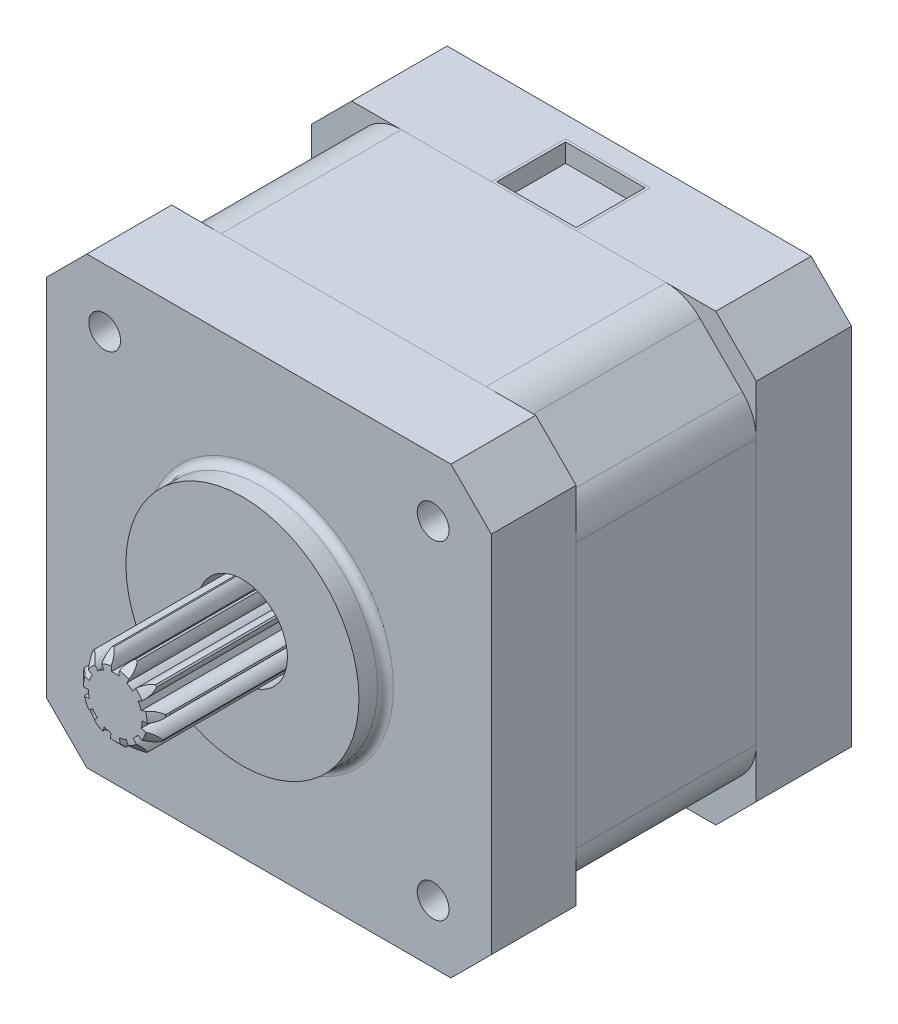
from build123d import *

# Parameters (mm, degrees)
BOSS_EXTRUDE1_DEPTH         = 8
BOSS_EXTRUDE2_DEPTH         = 17
BOSS_EXTRUDE3_DEPTH         = 9
SKETCH5_R                   = 1.5
CUT_EXTRUDE1_DEPTH          = 4.5
SKETCH6_R                   = 11
BOSS_EXTRUDE4_DEPTH         = 2.5
SKETCH9_R                   = 4.25
CUT_EXTRUDE2_DEPTH          = 3
SKETCH8_R                   = 3.9
BOSS_EXTRUDE5_DEPTH         = 15
SKETCH11_R                  = 4
SKETCH11_R_2                = 2.75
BOSS_EXTRUDE6_DEPTH         = 0.5
FILLET1_R                   = 0.75
SKETCH13_W                  = 8
SKETCH13_H                  = 7
CUT_EXTRUDE3_DEPTH          = 2
SKETCH14_W                  = 8
SKETCH14_H                  = 7
BOSS_EXTRUDE7_DEPTH         = 0.25
SKETCH15_W                  = 8
SKETCH15_H                  = 7
SKETCH15_W_2                = 7.5
SKETCH15_H_2                = 6.5
BOSS_EXTRUDE8_DEPTH         = 1.75
WYTNIJ_WYCI_GNI_CIE1_DEPTH  = 15
SZKIC2_R                    = 11
WYTNIJ_WYCI_GNI_CIE2_DEPTH  = 1
WYTNIJ_WYCI_GNI_CIE7_START  = -2
SZKIC2_4_R                  = 4.25
WYTNIJ_WYCI_GNI_CIE7_DEPTH  = 2
SZKIC3_R                    = 3.6
SZKIC3_R_2                  = 3.5
WYTNIJ_WYCI_GNI_CIE10_DEPTH = 5
SZKIC4_R                    = 0.5
WYTNIJ_WYCI_GNI_CIE11_DEPTH = 3
ZAOKR_GLENIE1_R             = 0.5
SFAZOWANIE1_SIZE            = 0.4
SZKIC5_R                    = 3.3
WYTNIJ_WYCI_GNI_CIE12_DEPTH = 3
WYTNIJ_WYCI_GNI_CIE13_START = -15
SZKIC5_3_R                  = 1.5
WYTNIJ_WYCI_GNI_CIE13_DEPTH = 15


with BuildPart() as part:
    # Sketch1 → Boss-Extrude1 (new body)
    with BuildSketch(Plane.XY):
        Polygon((17.183766184, 21), (-17.183766184, 21), (-21, 17.183766184), (-21, -17.183766184), (-17.183766184, -21), (17.183766184, -21), (21, -17.183766184), (21, 17.183766184), align=None)
    extrude(amount=-BOSS_EXTRUDE1_DEPTH)

    # Sketch5 → Cut-Extrude1 (cut)
    with BuildSketch(Plane.XY):
        with Locations((-15.5, 15.5)):
            Circle(SKETCH5_R)
        with Locations((15.5, 15.5)):
            Circle(SKETCH5_R)
        with Locations((15.5, -15.5)):
            Circle(SKETCH5_R)
        with Locations((-15.5, -15.5)):
            Circle(SKETCH5_R)
    extrude(amount=-CUT_EXTRUDE1_DEPTH, mode=Mode.SUBTRACT)

    # Sketch6 → Boss-Extrude4 (add)
    with BuildSketch(Plane.XY):
        with Locations(Location((0, 0, 0), (0, 0, 180))):
            Circle(SKETCH6_R)
    extrude(amount=BOSS_EXTRUDE4_DEPTH)

    # Sketch9 → Cut-Extrude2 (cut)
    with BuildSketch(Plane.XY.offset(2.5)):
        Circle(SKETCH9_R)
    extrude(amount=-CUT_EXTRUDE2_DEPTH, mode=Mode.SUBTRACT)

    # Sketch11 → Boss-Extrude6 (add)
    with BuildSketch(Plane.XY.offset(-0.5)):
        Circle(SKETCH11_R)
        Circle(SKETCH11_R_2, mode=Mode.SUBTRACT)
    extrude(amount=BOSS_EXTRUDE6_DEPTH)

    # Fillet1
    fillet1_edges = [part.edges().sort_by_distance(p)[0] for p in [
        (11, 0, 0),
    ]]
    fillet(fillet1_edges, radius=FILLET1_R)


with BuildPart() as body_2:
    # Sketch3 → Boss-Extrude2 (new body)
    with BuildSketch(Plane(origin=(0, 0, -8), x_dir=(-1, 0, 0), z_dir=(0, 0, -1))):
        with BuildLine():
            Line((-19.68807717, 15.66726189), (-15.66726189, 19.68807717))
            ThreePointArc((-15.66726189, 19.68807717), (-14.214109783, 20.659042365), (-12.5, 21))
            Line((-12.5, 21), (12.5, 21))
            ThreePointArc((12.5, 21), (14.214109783, 20.659042365), (15.66726189, 19.68807717))
            Line((15.66726189, 19.68807717), (19.68807717, 15.66726189))
            ThreePointArc((19.68807717, 15.66726189), (20.659042365, 14.214109783), (21, 12.5))
            Line((21, 12.5), (21, -12.5))
            ThreePointArc((21, -12.5), (20.659042365, -14.214109783), (19.68807717, -15.66726189))
            Line((19.68807717, -15.66726189), (15.66726189, -19.68807717))
            ThreePointArc((15.66726189, -19.68807717), (14.214109783, -20.659042365), (12.5, -21))
            Line((12.5, -21), (-12.5, -21))
            ThreePointArc((-12.5, -21), (-14.214109783, -20.659042365), (-15.66726189, -19.68807717))
            Line((-15.66726189, -19.68807717), (-19.68807717, -15.66726189))
            ThreePointArc((-19.68807717, -15.66726189), (-20.659042365, -14.214109783), (-21, -12.5))
            Line((-21, -12.5), (-21, 12.5))
            ThreePointArc((-21, 12.5), (-20.659042365, 14.214109783), (-19.68807717, 15.66726189))
        make_face()
    extrude(amount=BOSS_EXTRUDE2_DEPTH)


with BuildPart() as body_3:
    # Sketch4 → Boss-Extrude3 (new body)
    with BuildSketch(Plane(origin=(0, 0, -25), x_dir=(-1, 0, 0), z_dir=(0, 0, -1))):
        Polygon((-17.183766184, 21), (-21, 17.183766184), (-21, -17.183766184), (-17.183766184, -21), (17.183766184, -21), (21, -17.183766184), (21, 17.183766184), (17.183766184, 21), align=None)
    extrude(amount=BOSS_EXTRUDE3_DEPTH)

    # Sketch13 → Cut-Extrude3 (cut)
    with BuildSketch(Plane(origin=(0, 21, 0), x_dir=(1, 0, 0), z_dir=(0, 1, 0))):
        with Locations((0, 28.5)):
            Rectangle(SKETCH13_W, SKETCH13_H)
    extrude(amount=-CUT_EXTRUDE3_DEPTH, mode=Mode.SUBTRACT)

    # Szkic2 → Wytnij-wyciągnięcie2 (cut)
    with BuildSketch(Plane(origin=(0, 0, -34), x_dir=(-1, 0, 0), z_dir=(0, 0, -1))):
        Circle(SZKIC2_R)
    extrude(amount=-WYTNIJ_WYCI_GNI_CIE2_DEPTH, mode=Mode.SUBTRACT)

    # Szkic2<4> → Wytnij-wyciągnięcie7 (cut)
    with BuildSketch(Plane(origin=(0, 0, -34), x_dir=(-1, 0, 0), z_dir=(0, 0, -1)).offset(WYTNIJ_WYCI_GNI_CIE7_START)):
        Circle(SZKIC2_4_R)
    extrude(amount=WYTNIJ_WYCI_GNI_CIE7_DEPTH, mode=Mode.SUBTRACT)

    # Szkic3 → Wytnij-wyciągnięcie10 (cut)
    with BuildSketch(Plane(origin=(0, 0, -32), x_dir=(-1, 0, 0), z_dir=(0, 0, -1))):
        Circle(SZKIC3_R)
        Circle(SZKIC3_R_2, mode=Mode.SUBTRACT)
    extrude(amount=-WYTNIJ_WYCI_GNI_CIE10_DEPTH, mode=Mode.SUBTRACT)

    # Szkic4 → Wytnij-wyciągnięcie11 (cut)
    with BuildSketch(Plane(origin=(0, 0, -32), x_dir=(-1, 0, 0), z_dir=(0, 0, -1))):
        Circle(SZKIC4_R)
    extrude(amount=-WYTNIJ_WYCI_GNI_CIE11_DEPTH, mode=Mode.SUBTRACT)

    # Zaokrąglenie1
    zaokr_glenie1_edges = [body_3.edges().sort_by_distance(p)[0] for p in [
        (0.5, 0, -29),
    ]]
    fillet(zaokr_glenie1_edges, radius=ZAOKR_GLENIE1_R)

    # Sfazowanie1
    sfazowanie1_edges = [body_3.edges().sort_by_distance(p)[0] for p in [
        (3.5, 0, -32),
        (0.5, 0, -32),
    ]]
    chamfer(sfazowanie1_edges, length=SFAZOWANIE1_SIZE)

    # Szkic5 → Wytnij-wyciągnięcie12 (cut)
    with BuildSketch(Plane(origin=(0, 0, -34), x_dir=(-1, 0, 0), z_dir=(0, 0, -1))):
        with Locations((-15.5, -15.5)):
            Circle(SZKIC5_R)
        with Locations((-15.5, 15.5)):
            Circle(SZKIC5_R)
        with Locations((15.5, 15.5)):
            Circle(SZKIC5_R)
        with Locations((15.5, -15.5)):
            Circle(SZKIC5_R)
    extrude(amount=-WYTNIJ_WYCI_GNI_CIE12_DEPTH, mode=Mode.SUBTRACT)


with BuildPart() as body_4:
    # Sketch8 → Boss-Extrude5 (new body)
    with BuildSketch(Plane.XY.offset(-0.5)):
        Circle(SKETCH8_R)
    extrude(amount=BOSS_EXTRUDE5_DEPTH)

    # Sketch12 → Cut-Revolve1 (revolve, cut)
    with BuildSketch(Plane(origin=(0, 0, 0), x_dir=(0, 0, -1), z_dir=(1, 0, 0)), mode=Mode.PRIVATE) as cut_revolve1_sk:
        Polygon((-14.5, 3), (-13.6, 3.9), (-14.5, 3.9), align=None)
    revolve(cut_revolve1_sk.sketch.rotate(Axis((0, 0, 14.5), (0, 0, -1)), 90), axis=Axis((0, 0, 14.5), (0, 0, -1)), mode=Mode.SUBTRACT)

    # Szkic1 → Wytnij-wyciągnięcie1 (cut)
    with BuildSketch(Plane.XY.offset(14.5)):
        with BuildLine():
            ThreePointArc((2.135117026, -1.39236356), (2.777621457, -1.745412812), (3.50940115, -1.701206503))
            ThreePointArc((3.50940115, -1.701206503), (2.94742334, -2.553956862), (2.183330531, -3.231573579))
            ThreePointArc((2.183330531, -3.231573579), (2.122943774, -2.500951134), (1.682050141, -1.915230619))
            ThreePointArc((1.682050141, -1.915230619), (1.926405665, -1.669240011), (2.135117026, -1.39236356))
        make_face()
        with BuildLine():
            ThreePointArc((3.583855103, -1.538175087), (3.860303623, -0.555027869), (3.87203779, 0.466179526))
            ThreePointArc((3.87203779, 0.466179526), (3.280325273, 0.033360841), (2.548943315, -0.01699935))
            ThreePointArc((2.548943315, -0.01699935), (2.523054855, -0.362760523), (2.450482471, -0.701809561))
            ThreePointArc((2.450482471, -0.701809561), (3.138050215, -0.956183919), (3.583855103, -1.538175087))
        make_face()
        with BuildLine():
            ThreePointArc((3.846531003, 0.643583127), (3.547564782, 1.620118551), (3.00532979, 2.485556849))
            ThreePointArc((3.00532979, 2.485556849), (2.741548992, 1.801542663), (2.153498111, 1.363762034))
            ThreePointArc((2.153498111, 1.363762034), (2.318651956, 1.058892868), (2.44090393, 0.734431074))
            ThreePointArc((2.44090393, 0.734431074), (3.156847886, 0.892164934), (3.846531003, 0.643583127))
        make_face()
        with BuildLine():
            ThreePointArc((2.887960488, 2.621008245), (2.108499188, 3.280888778), (1.184450816, 3.715787435))
            ThreePointArc((1.184450816, 3.715787435), (1.332350277, 2.997747418), (1.074332473, 2.311538608))
            ThreePointArc((1.074332473, 2.311538608), (1.378093444, 2.144355255), (1.656355639, 1.937495032))
            ThreePointArc((1.656355639, 1.937495032), (2.173368657, 2.457257724), (2.887960488, 2.621008245))
        make_face()
        with BuildLine():
            ThreePointArc((1.012482923, 3.766281765), (0.499860237, 3.242188549), (0.345926135, 2.525418007))
            ThreePointArc((0.345926135, 2.525418007), (0, 2.549), (-0.345926135, 2.525418007))
            ThreePointArc((-0.345926135, 2.525418007), (-0.499860237, 3.242188549), (-1.012482923, 3.766281765))
            ThreePointArc((-1.012482923, 3.766281765), (0, 3.9), (1.012482923, 3.766281765))
        make_face()
        with BuildLine():
            ThreePointArc((-1.184450816, 3.715787435), (-2.108499188, 3.280888778), (-2.887960488, 2.621008245))
            ThreePointArc((-2.887960488, 2.621008245), (-2.173368657, 2.457257724), (-1.656355639, 1.937495032))
            ThreePointArc((-1.656355639, 1.937495032), (-1.378093444, 2.144355255), (-1.074332473, 2.311538608))
            ThreePointArc((-1.074332473, 2.311538608), (-1.332350277, 2.997747418), (-1.184450816, 3.715787435))
        make_face()
        with BuildLine():
            ThreePointArc((-3.00532979, 2.485556849), (-3.547564782, 1.620118551), (-3.846531003, 0.643583127))
            ThreePointArc((-3.846531003, 0.643583127), (-3.156847886, 0.892164934), (-2.44090393, 0.734431074))
            ThreePointArc((-2.44090393, 0.734431074), (-2.318651956, 1.058892868), (-2.153498111, 1.363762034))
            ThreePointArc((-2.153498111, 1.363762034), (-2.741548992, 1.801542663), (-3.00532979, 2.485556849))
        make_face()
        with BuildLine():
            ThreePointArc((-3.87203779, 0.466179526), (-3.860303623, -0.555027869), (-3.583855103, -1.538175087))
            ThreePointArc((-3.583855103, -1.538175087), (-3.138050215, -0.956183919), (-2.450482471, -0.701809561))
            ThreePointArc((-2.450482471, -0.701809561), (-2.523054855, -0.362760523), (-2.548943315, -0.01699935))
            ThreePointArc((-2.548943315, -0.01699935), (-3.280325273, 0.033360841), (-3.87203779, 0.466179526))
        make_face()
        with BuildLine():
            ThreePointArc((-3.50940115, -1.701206503), (-2.94742334, -2.553956862), (-2.183330531, -3.231573579))
            ThreePointArc((-2.183330531, -3.231573579), (-2.122943774, -2.500951134), (-1.682050141, -1.915230619))
            ThreePointArc((-1.682050141, -1.915230619), (-1.926405665, -1.669240011), (-2.135117026, -1.39236356))
            ThreePointArc((-2.135117026, -1.39236356), (-2.777621457, -1.745412812), (-3.50940115, -1.701206503))
        make_face()
        with BuildLine():
            ThreePointArc((-2.032554442, -3.328471487), (-1.098756972, -3.742022597), (-0.089613941, -3.898970292))
            ThreePointArc((-0.089613941, -3.898970292), (-0.433817685, -3.251684034), (-0.379578776, -2.520579487))
            ThreePointArc((-0.379578776, -2.520579487), (-0.718136287, -2.44574759), (-1.043406168, -2.325662179))
            ThreePointArc((-1.043406168, -2.325662179), (-1.393042454, -2.970030229), (-2.032554442, -3.328471487))
        make_face()
        with BuildLine():
            ThreePointArc((0.089613941, -3.898970292), (1.098756972, -3.742022597), (2.032554442, -3.328471487))
            ThreePointArc((2.032554442, -3.328471487), (1.393042454, -2.970030229), (1.043406168, -2.325662179))
            ThreePointArc((1.043406168, -2.325662179), (0.718136287, -2.44574759), (0.379578776, -2.520579487))
            ThreePointArc((0.379578776, -2.520579487), (0.433817685, -3.251684034), (0.089613941, -3.898970292))
        make_face()
    extrude(amount=-WYTNIJ_WYCI_GNI_CIE1_DEPTH, mode=Mode.SUBTRACT)


with BuildPart() as body_5:
    # Sketch14 → Boss-Extrude7 (new body)
    with BuildSketch(Plane(origin=(0, 19, 0), x_dir=(1, 0, 0), z_dir=(0, 1, 0))):
        with Locations((0, 28.5)):
            Rectangle(SKETCH14_W, SKETCH14_H)
    extrude(amount=BOSS_EXTRUDE7_DEPTH)

    # Sketch15 → Boss-Extrude8 (add)
    with BuildSketch(Plane(origin=(0, 19.25, 0), x_dir=(1, 0, 0), z_dir=(0, 1, 0))):
        with Locations((0, 28.5)):
            Rectangle(SKETCH15_W, SKETCH15_H)
        with Locations((0, 28.5)):
            Rectangle(SKETCH15_W_2, SKETCH15_H_2, mode=Mode.SUBTRACT)
    extrude(amount=BOSS_EXTRUDE8_DEPTH)


with BuildPart() as wytnij_wyci_gni_cie13_tool:
    # Szkic5<3> → Wytnij-wyciągnięcie13 (new body)
    with BuildSketch(Plane(origin=(0, 0, -34), x_dir=(-1, 0, 0), z_dir=(0, 0, -1)).offset(WYTNIJ_WYCI_GNI_CIE13_START)):
        with Locations((15.5, -15.5)):
            Circle(SZKIC5_3_R)
        with Locations((15.5, 15.5)):
            Circle(SZKIC5_3_R)
        with Locations((-15.5, 15.5)):
            Circle(SZKIC5_3_R)
        with Locations((-15.5, -15.5)):
            Circle(SZKIC5_3_R)
    extrude(amount=WYTNIJ_WYCI_GNI_CIE13_DEPTH)


with BuildPart() as body_2_1:
    add(body_2.part)

    # Wytnij-wyciągnięcie13: cut by wytnij_wyci_gni_cie13_tool
    add(wytnij_wyci_gni_cie13_tool.part, mode=Mode.SUBTRACT)


with BuildPart() as body_3_1:
    add(body_3.part)

    # Wytnij-wyciągnięcie13: cut by wytnij_wyci_gni_cie13_tool
    add(wytnij_wyci_gni_cie13_tool.part, mode=Mode.SUBTRACT)


solid = Compound([part.part, body_4.part, body_5.part, body_2_1.part, body_3_1.part])
